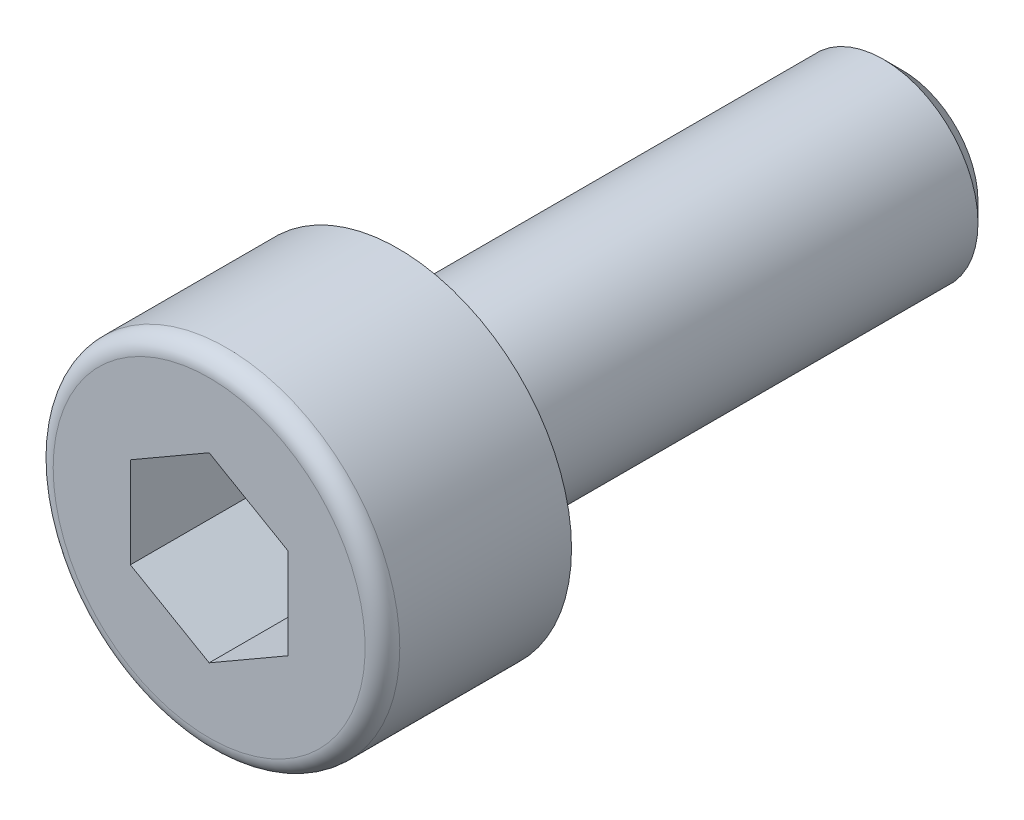
from build123d import *

# Parameters (mm, degrees)
CUT_EXTRUDE_1_DEPTH = 1.925
FILLET_1_R          = 0.275
CHAMFER_1_SIZE      = 0.3


with BuildPart() as part:
    # 草图3 → 旋转1 (revolve)
    with BuildSketch(Plane(origin=(0, 0, 0), x_dir=(0, 0, -1), z_dir=(1, 0, 0)), mode=Mode.PRIVATE) as revolve_1_sk:
        Polygon((-3, 0), (-3, 2.75), (0, 2.75), (0, 1.5), (8, 1.5), (8, 0), align=None)
    revolve(revolve_1_sk.sketch.rotate(Axis((0, 0, 3), (0, 0, -1)), 90), axis=Axis((0, 0, 3), (0, 0, -1)))

    # 草图4 → 切除-拉伸1 (cut)
    with BuildSketch(Plane.XY.offset(3)):
        Polygon((0, 1.443375673), (-1.25, 0.721687836), (-1.25, -0.721687836), (0, -1.443375673), (1.25, -0.721687836), (1.25, 0.721687836), align=None)
    extrude(amount=-CUT_EXTRUDE_1_DEPTH, mode=Mode.SUBTRACT)

    # 圆角1
    fillet_1_edges = [part.edges().sort_by_distance(p)[0] for p in [
        (-2.75, 0, 3),
    ]]
    fillet(fillet_1_edges, radius=FILLET_1_R)

    # 倒角1
    chamfer_1_edges = [part.edges().sort_by_distance(p)[0] for p in [
        (-1.5, 0, -8),
    ]]
    chamfer(chamfer_1_edges, length=CHAMFER_1_SIZE)


solid = part.part
